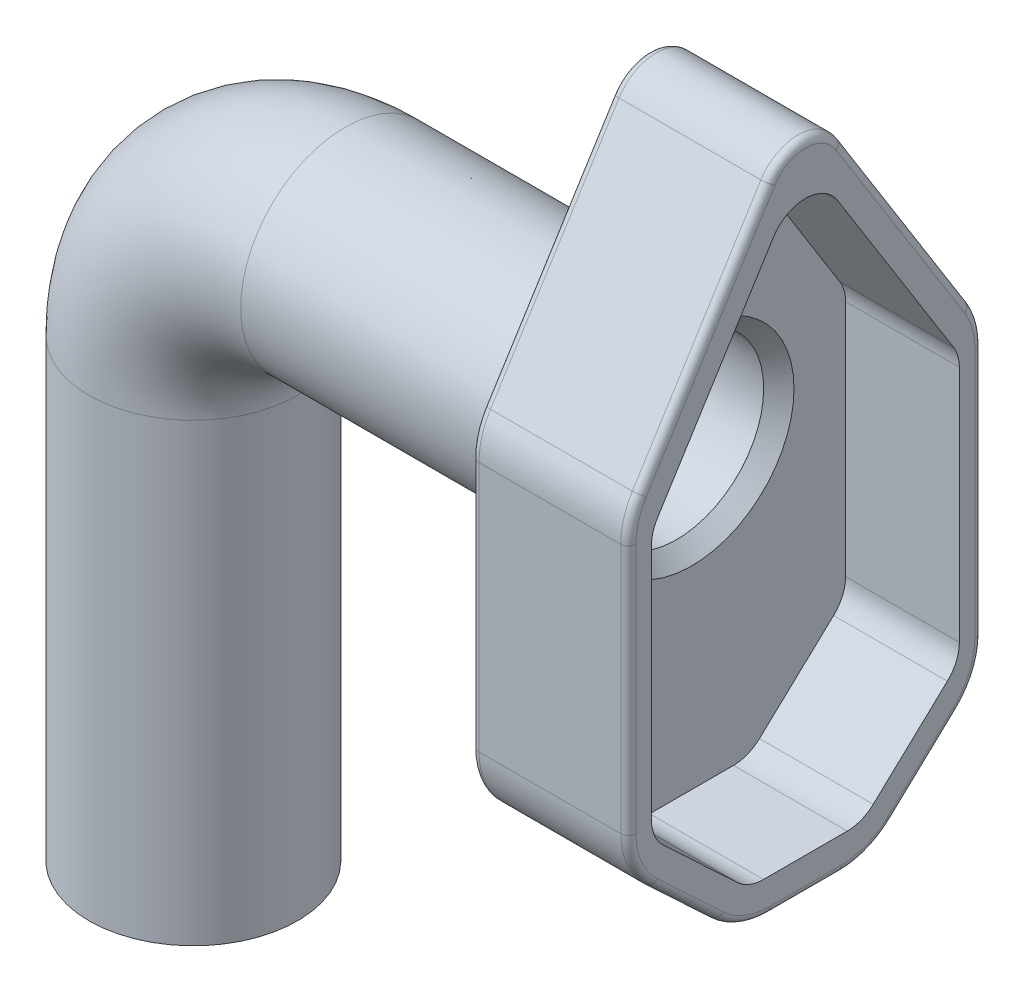
from build123d import *

# Parameters (mm, degrees)
BOSS_EXTRUDE1_DEPTH  = 18
SCALE1_SCALE         = 1.15
CUT_EXTRUDE1_DEPTH   = 15
FILLET1_R            = 10
FILLET2_R            = 5
FILLET3_R            = 1
FILLET4_R            = 1
SKETCH9_R            = 11.5
CUT_EXTRUDE2_DEPTH   = 72.03051567
CHAMFER1_SIZE        = 2
SWEEP1_PROFILE_R     = 13.75
CUT_SWEEP2_PROFILE_R = 11.5
SKETCH13_W           = 4.429427916
SKETCH13_H           = 5.487691531
CUT_EXTRUDE3_DEPTH   = 10
SKETCH34_W           = 2.806069431
SKETCH34_H           = 2.063682343
CUT_EXTRUDE6_DEPTH   = 2


with BuildPart() as part:
    # Sketch1 → Boss-Extrude1 (new body)
    with BuildSketch(Plane.YZ):
        with BuildLine():
            Line((-35, -40.6), (0, -40.6))
            Line((0, -40.6), (25.653410767, -24.537854564))
            ThreePointArc((25.653410767, -24.537854564), (28, -20.3), (25.653410767, -16.062145436))
            Line((25.653410767, -16.062145436), (0, 0))
            Line((0, 0), (-35, 0))
            Line((-35, 0), (-47, -12.8))
            Line((-47, -12.8), (-47, -27.8))
            Line((-47, -27.8), (-35, -40.6))
        make_face()
    extrude(amount=BOSS_EXTRUDE1_DEPTH)


with BuildPart() as part_1:
    # Scale1: scaled about (9, -13.156905102, -20.3)
    add(part.part.scale(SCALE1_SCALE).moved(Location((-1.35, 1.973535765, 3.045))))

    # Sketch7 → Cut-Extrude1 (cut)
    with BuildSketch(Plane.YZ.offset(19.35)):
        with BuildLine():
            Line((-35.576464235, -40.6), (-0.576464235, -40.6))
            Line((-0.576464235, -40.6), (25.076946532, -24.537854564))
            ThreePointArc((25.076946532, -24.537854564), (27.423535765, -20.3), (25.076946532, -16.062145436))
            Line((25.076946532, -16.062145436), (-0.576464235, 0))
            Line((-0.576464235, 0), (-35.576464235, 0))
            Line((-35.576464235, 0), (-47.576464235, -12.8))
            Line((-47.576464235, -12.8), (-47.576464235, -27.8))
            Line((-47.576464235, -27.8), (-35.576464235, -40.6))
        make_face()
    extrude(amount=-CUT_EXTRUDE1_DEPTH, mode=Mode.SUBTRACT)

    # Fillet1
    fillet1_edges = [part_1.edges().sort_by_distance(p)[0] for p in [
        (9, 1.973535765, 3.045),
        (9, -38.276464235, 3.045),
        (9, -52.076464235, -11.675),
        (9, -52.076464235, -28.925),
        (9, 1.973535765, -43.645),
        (9, -38.276464235, -43.645),
    ]]
    fillet(fillet1_edges, radius=FILLET1_R)

    # Fillet2
    fillet2_edges = [part_1.edges().sort_by_distance(p)[0] for p in [
        (11.85, -0.576464235, -40.6),
        (11.85, -35.576464235, -40.6),
        (11.85, -47.576464235, -27.8),
        (11.85, -47.576464235, -12.8),
        (11.85, -0.576464235, 0),
        (11.85, -35.576464235, 0),
    ]]
    fillet(fillet2_edges, radius=FILLET2_R)

    # Fillet3
    fillet3_edges = [part_1.edges().sort_by_distance(p)[0] for p in [
        (19.35, -45.305676214, -36.147173889),
        (19.35, -51.375757767, -28.647907393),
        (19.35, -52.076464235, -20.3),
        (19.35, -51.375757767, -11.952092607),
        (19.35, -45.305676214, -4.452826111),
        (19.35, -37.919435742, 2.220895403),
        (19.35, -17.421465972, 3.045),
        (19.35, 1.861910332, 2.656375845),
        (19.35, 17.941495924, -6.952879062),
        (19.35, 34.173535765, -20.3),
        (19.35, 17.941495924, -33.647120938),
        (19.35, 1.861910332, -43.256375845),
        (19.35, -17.421465972, -43.645),
        (19.35, -37.919435742, -42.820895403),
    ]]
    fillet(fillet3_edges, radius=FILLET3_R)

    # Fillet4
    fillet4_edges = [part_1.edges().sort_by_distance(p)[0] for p in [
        (-1.35, 1.861910332, -43.256375845),
        (-1.35, 17.941495924, -33.647120938),
        (-1.35, 34.173535765, -20.3),
        (-1.35, 17.941495924, -6.952879062),
        (-1.35, 1.861910332, 2.656375845),
        (-1.35, -17.421465972, 3.045),
        (-1.35, -37.919435742, 2.220895403),
        (-1.35, -45.305676214, -4.452826111),
        (-1.35, -51.375757767, -11.952092607),
        (-1.35, -52.076464235, -20.3),
        (-1.35, -51.375757767, -28.647907393),
        (-1.35, -45.305676214, -36.147173889),
        (-1.35, -37.919435742, -42.820895403),
        (-1.35, -17.421465972, -43.645),
    ]]
    fillet(fillet4_edges, radius=FILLET4_R)

    # Sketch9 → Cut-Extrude2 (cut, through all)
    with BuildSketch(Plane(origin=(-1.35, 0, 0), x_dir=(0, -1, 0), z_dir=(-1, 0, 0))):
        with Locations((8.54339023, -20.3)):
            Circle(SKETCH9_R)
    extrude(amount=-CUT_EXTRUDE2_DEPTH, mode=Mode.SUBTRACT)

    # Chamfer1
    chamfer1_edges = [part_1.edges().sort_by_distance(p)[0] for p in [
        (4.35, 2.95660977, -20.3),
    ]]
    chamfer(chamfer1_edges, length=CHAMFER1_SIZE)

    # Sweep1: sweep along a path in Sketch11
    with BuildLine(Plane.XY.offset(-20.3)) as sweep1_path:
        Line((-1.35, -8.54339023), (-41.35, -8.54339023))
        ThreePointArc((-41.35, -8.54339023), (-55.492135624, -14.401254607), (-61.35, -28.54339023))
        Line((-61.35, -28.54339023), (-61.35, -88.54339023))
    # Sweep1 profile (on start of the path) → Sweep1 (sweep)
    with BuildSketch(Plane(origin=(-1.35, -8.54339023, -20.3), x_dir=(0, -1, 0), z_dir=(-1, 0, 0))):
        Circle(SWEEP1_PROFILE_R)
    sweep(path=sweep1_path.line)

    # Cut-Sweep2: sweep along a path in Sketch11<3>
    with BuildLine(Plane.XY.offset(-20.3)) as cut_sweep2_path:
        Line((-1.35, -8.54339023), (-41.35, -8.54339023))
        ThreePointArc((-41.35, -8.54339023), (-55.492135624, -14.401254607), (-61.35, -28.54339023))
        Line((-61.35, -28.54339023), (-61.35, -88.54339023))
    # Cut-Sweep2 profile (on start of the path) → Cut-Sweep2 (sweep, cut)
    with BuildSketch(Plane(origin=(-1.35, -8.54339023, -20.3), x_dir=(0, -1, 0), z_dir=(-1, 0, 0))):
        Circle(CUT_SWEEP2_PROFILE_R)
    sweep(path=cut_sweep2_path.line, mode=Mode.SUBTRACT)

    # Sketch13 → Cut-Extrude3 (cut)
    with BuildSketch(Plane.XZ.offset(88.54339023)):
        with Locations((-61.35, -30.148697086)):
            Rectangle(SKETCH13_W, SKETCH13_H)
    extrude(amount=-CUT_EXTRUDE3_DEPTH, mode=Mode.SUBTRACT)

    # Sketch34 → Cut-Extrude6 (cut)
    with BuildSketch(Plane.YZ.offset(-63.564713958)):
        with Locations((-79.980636632, -31.987266617)):
            Rectangle(SKETCH34_W, SKETCH34_H)
    extrude(amount=-CUT_EXTRUDE6_DEPTH, mode=Mode.SUBTRACT)


solid = part_1.part
